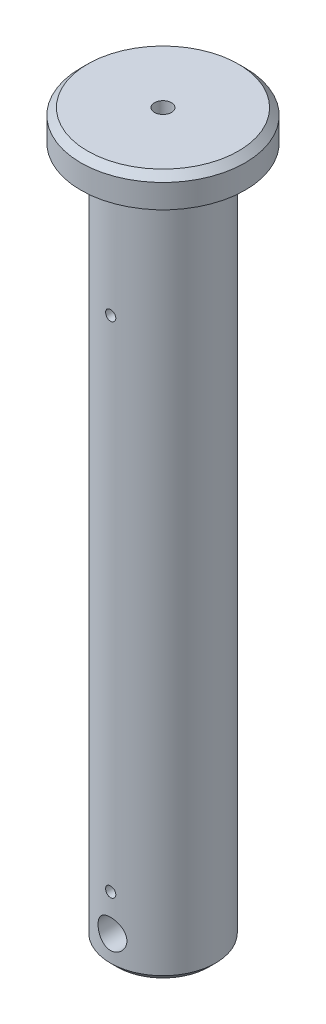
from build123d import *

# Parameters (mm, degrees)
ESBO_O2_R                  = 1.5
CORTE_EXTRUS_O1_DEPTH      = 127.487894678
CORTE_EXTRUS_O2_DEPTH      = 127.487894678
CORTE_EXTRUS_O2_DEPTH_BACK = 127.487894678
ESBO_O3_R                  = 4.25


with BuildPart() as part:
    # Esboço1 → Revolução1 (revolve)
    with BuildSketch(Plane(origin=(0, 0, 0), x_dir=(0, 0, -1), z_dir=(1, 0, 0)), mode=Mode.PRIVATE) as revolu_o1_sk:
        Polygon((2.5, 91.149139381), (22.25, 91.149139381), (24.25, 89.149139381), (24.25, 82.149139381), (15.5, 82.149139381), (15.5, -119.75), (13.5, -121.75), (0, -121.75), (0, -81.75), (1.5, -80.848709071), (1.5, 81.149139381), (2.5, 81.75), align=None)
    revolve(revolu_o1_sk.sketch.rotate(Axis((0, 121.75, 0), (0, -1, 0)), 180), axis=Axis((0, 121.75, 0), (0, -1, 0)))

    # Esboço2 → Corte-extrusão1 (cut, through all)
    with BuildSketch(Plane.XY):
        with Locations(Location((0, 45.799139381, 0), (0, 0, 90))):
            Circle(ESBO_O2_R)
        with Locations(Location((0, -101.500860619, 0), (0, 0, 90))):
            Circle(ESBO_O2_R)
    extrude(amount=CORTE_EXTRUS_O1_DEPTH, mode=Mode.SUBTRACT)

    # Esboço3 → Corte-extrusão2 (cut, two sides: drawn at the far end of the back side and taken through both)
    with BuildSketch(Plane.XY.offset(-CORTE_EXTRUS_O2_DEPTH_BACK)):
        with Locations((0, -112.25)):
            Circle(ESBO_O3_R)
    extrude(amount=CORTE_EXTRUS_O2_DEPTH + CORTE_EXTRUS_O2_DEPTH_BACK, mode=Mode.SUBTRACT)


solid = part.part
